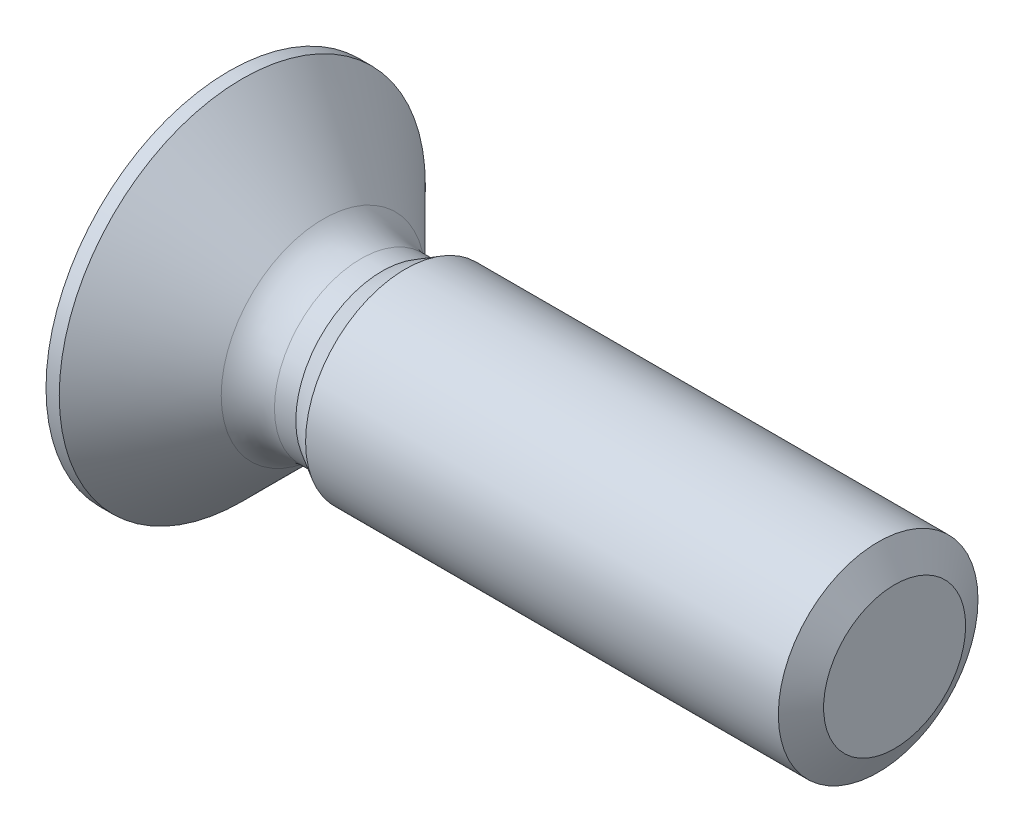
from build123d import *

# Parameters (mm, degrees)
PATTERN_CIRCULAR_1_COUNT = 2
PATTERN_CIRCULAR_1_ANGLE = 90


with BuildPart() as part:
    # 草图1 → Revolve 779 (revolve)
    with BuildSketch(Plane.XY, mode=Mode.PRIVATE) as revolve_779_sk:
        with BuildLine():
            Line((0, 0), (0, 2.75))
            Line((0, 2.75), (0.199, 2.75))
            Line((0.199, 2.75), (1.415685425, 1.533314575))
            ThreePointArc((1.415685425, 1.533314575), (1.675224104, 1.359896374), (1.98137085, 1.299))
            Line((1.98137085, 1.299), (2.301857788, 1.299))
            Line((2.301857788, 1.299), (2.65, 1.5))
            Line((2.65, 1.5), (10, 1.5))
            Line((10, 1.5), (10, 0))
            Line((10, 0), (0, 0))
        make_face()
    revolve(revolve_779_sk.sketch.rotate(Axis((0, 0, 0), (1, 0, 0)), 90), axis=Axis((0, 0, 0), (1, 0, 0)))

    # 草图2 → 切除-旋转1 (revolve, cut)
    with BuildSketch(Plane.XY, mode=Mode.PRIVATE) as cut_revolve_1_sk:
        Polygon((9.752708003, 1.5), (10.252708003, 1.5), (10, 1.067), align=None)
    revolve(cut_revolve_1_sk.sketch.rotate(Axis((0, 0, 0), (-1, 0, 0)), 270), axis=Axis((0, 0, 0), (-1, 0, 0)), mode=Mode.SUBTRACT)

    # 草图3 → 切除-放样1 section 0
    with BuildSketch(Plane.ZY, mode=Mode.PRIVATE) as loft_1_s0:
        with BuildLine():
            Line((-1.6, 0.25), (1.6, 0.25))
            Line((1.6, 0.25), (1.6, -0.25))
            Line((1.6, -0.25), (-1.6, -0.25))
            Line((-1.6, -0.25), (-1.6, 0.25))
        make_face()
    loft_1 = loft([loft_1_s0.sketch, Vertex(2.1, 0, 0)], mode=Mode.SUBTRACT)

    # 阵列(圆周)1: 切除-放样1 ×2 about axis
    pattern_circular_1_axis = Axis((0, 0, 0), (1, 0, 0))
    for i in range(1, PATTERN_CIRCULAR_1_COUNT):
        add(loft_1.rotate(pattern_circular_1_axis, i * PATTERN_CIRCULAR_1_ANGLE / (PATTERN_CIRCULAR_1_COUNT - 1)), mode=Mode.SUBTRACT)


solid = part.part
